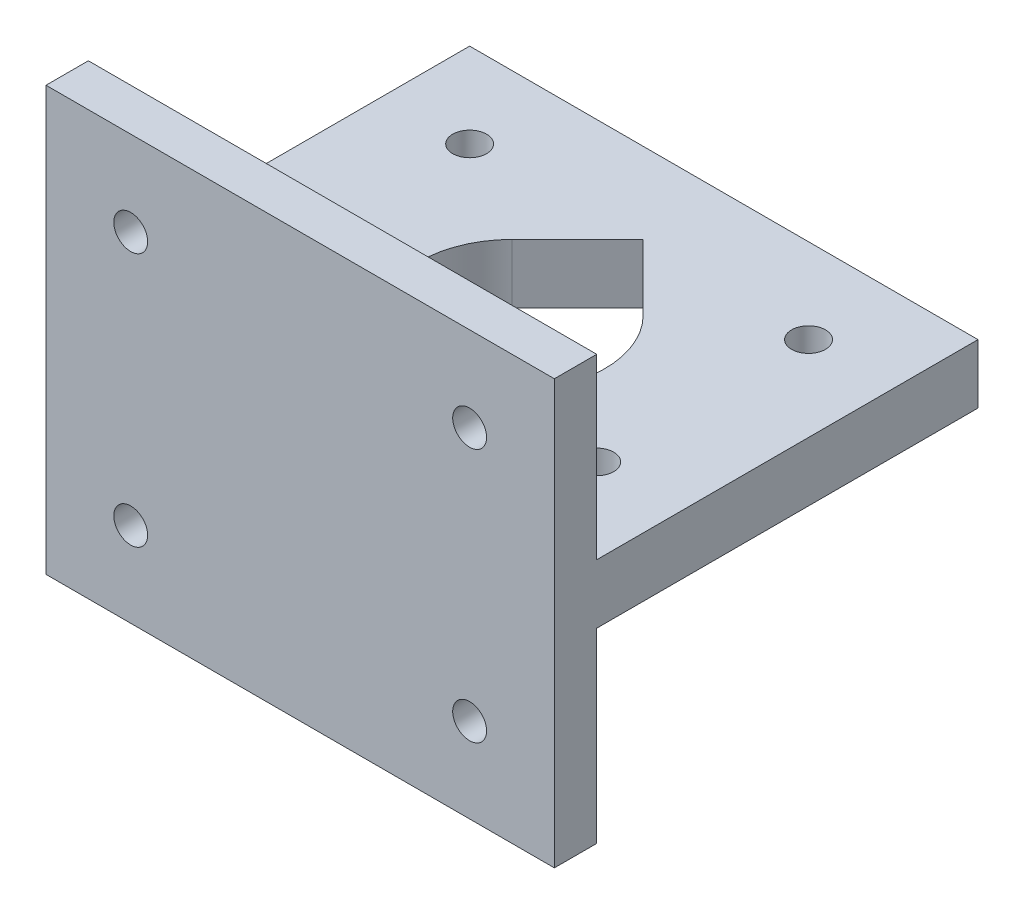
from build123d import *

# Parameters (mm, degrees)
SKETCH_2_W           = 60
SKETCH_2_H           = 50
SKETCH_2_R           = 10.85
EXTRUDE_1_DEPTH      = 7
SKETCH_4_W           = 60
SKETCH_4_H           = 5
EXTRUDE_2_DEPTH      = 25
SKETCH_6_R           = 2
CUT_EXTRUDE_1_DEPTH  = 50
SKETCH_8_R           = 2
CUT_EXTRUDE_4_DEPTH  = 50
SKETCH_10_R          = 10.95
CUT_EXTRUDE_5_DEPTH  = 10
SKETCH_14_R          = 10.95
CUT_EXTRUDE_12_DEPTH = 10


with BuildPart() as part:
    # 草图2 → 凸台-拉伸1 (new body)
    with BuildSketch(Plane(origin=(0, 0, 0), x_dir=(1, 0, 0), z_dir=(0, 1, 0))):
        Rectangle(SKETCH_2_W, SKETCH_2_H)
        with Locations(Location((0, 0, 0), (0, 0, 270))):
            Circle(SKETCH_2_R, mode=Mode.SUBTRACT)
    extrude(amount=EXTRUDE_1_DEPTH)

    # 草图4 → 凸台-拉伸2 (add, symmetric)
    with BuildSketch(Plane(origin=(0, 3, 0), x_dir=(1, 0, 0), z_dir=(0, 1, 0))):
        with Locations((0, -22.5)):
            Rectangle(SKETCH_4_W, SKETCH_4_H)
    extrude(amount=EXTRUDE_2_DEPTH, both=True)

    # 草图6 → 切除-拉伸1 (cut)
    with BuildSketch(Plane.XY.offset(25)):
        with BuildLine():
            ThreePointArc((-18, 18), (-18.585786438, 19.414213562), (-20, 20))
            Line((-20, 20), (-20, 18))
            Line((-20, 18), (-22, 18))
            ThreePointArc((-22, 18), (-20, 16), (-18, 18))
        make_face()
        with BuildLine():
            Line((-20, 18), (-20, 20))
            ThreePointArc((-20, 20), (-21.414213562, 19.414213562), (-22, 18))
            Line((-22, 18), (-20, 18))
        make_face()
        with Locations((20, 18)):
            Circle(SKETCH_6_R)
        with Locations((-20, -12)):
            Circle(SKETCH_6_R)
        with Locations((20, -12)):
            Circle(SKETCH_6_R)
    extrude(amount=-CUT_EXTRUDE_1_DEPTH, mode=Mode.SUBTRACT)

    # 草图8 → 切除-拉伸4 (cut)
    with BuildSketch(Plane.XZ):
        with BuildLine():
            ThreePointArc((-18, 10), (-18.585786438, 11.414213562), (-20, 12))
            Line((-20, 12), (-20, 10))
            Line((-20, 10), (-22, 10))
            ThreePointArc((-22, 10), (-20, 8), (-18, 10))
        make_face()
        with BuildLine():
            Line((-20, 10), (-20, 12))
            ThreePointArc((-20, 12), (-21.414213562, 11.414213562), (-22, 10))
            Line((-22, 10), (-20, 10))
        make_face()
        with Locations(Location((20, 10, 0), (0, 0, 270))):
            Circle(SKETCH_8_R)
        with Locations(Location((20, -15, 0), (0, 0, 270))):
            Circle(SKETCH_8_R)
        with Locations(Location((-20, -15, 0), (0, 0, 270))):
            Circle(SKETCH_8_R)
    extrude(amount=-CUT_EXTRUDE_4_DEPTH, mode=Mode.SUBTRACT)

    # 草图10 → 切除-拉伸5 (cut)
    with BuildSketch(Plane(origin=(0, 7, 0), x_dir=(1, 0, 0), z_dir=(0, 1, 0))):
        with Locations(Location((0, 0, 0), (0, 0, 270))):
            Circle(SKETCH_10_R)
    extrude(amount=-CUT_EXTRUDE_5_DEPTH, mode=Mode.SUBTRACT)

    # 草图14 → 切除-拉伸12 (cut)
    with BuildSketch(Plane(origin=(0, 7, 0), x_dir=(1, 0, 0), z_dir=(0, 1, 0))):
        with BuildLine():
            ThreePointArc((-7.742819254, 7.742819254), (-4.190383584, 10.116480881), (0, 10.95))
            Line((0, 10.95), (0, 15.485638508))
            Line((0, 15.485638508), (-7.742819254, 7.742819254))
        make_face()
        with BuildLine():
            Line((0, 15.485638508), (0, 10.95))
            ThreePointArc((0, 10.95), (4.190383584, 10.116480881), (7.742819254, 7.742819254))
            Line((7.742819254, 7.742819254), (0, 15.485638508))
        make_face()
        Circle(SKETCH_14_R)
    extrude(amount=-CUT_EXTRUDE_12_DEPTH, mode=Mode.SUBTRACT)


solid = part.part
